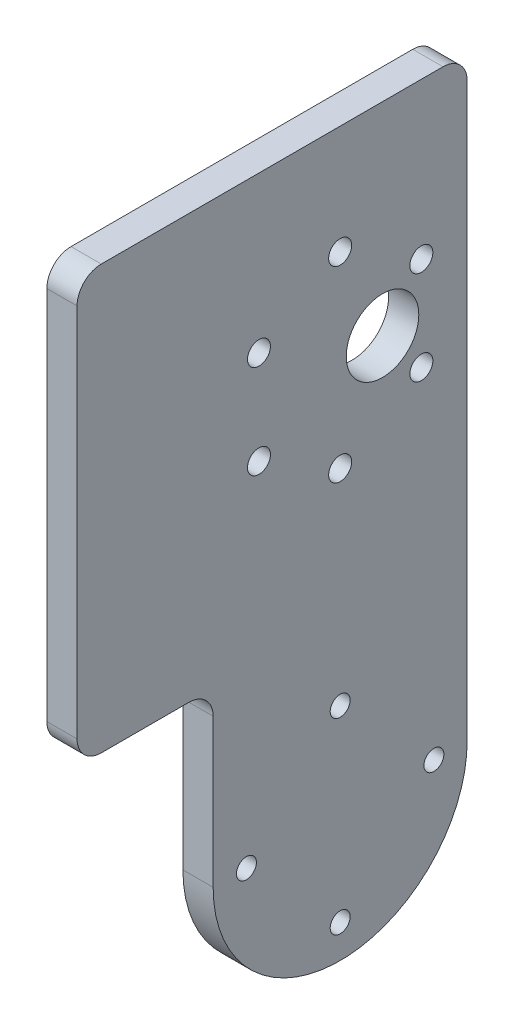
from build123d import *

# Parameters (mm, degrees)
SKETCH1_R           = 1.65
SKETCH1_R_2         = 1.9
SKETCH1_R_3         = 6
BOSS_EXTRUDE1_DEPTH = 5


with BuildPart() as part:
    # Sketch1 → Boss-Extrude1 (new body)
    with BuildSketch(Plane.YZ):
        with BuildLine():
            Line((0, 0), (94.5, 0))
            ThreePointArc((94.5, 0), (97.328427125, 1.171572875), (98.5, 4))
            Line((98.5, 4), (98.5, 60.5))
            ThreePointArc((98.5, 60.5), (97.328427125, 63.328427125), (94.5, 64.5))
            Line((94.5, 64.5), (32.5, 64.5))
            ThreePointArc((32.5, 64.5), (29.671572875, 63.328427125), (28.5, 60.5))
            Line((28.5, 60.5), (28.5, 46))
            ThreePointArc((28.5, 46), (27.328427125, 43.171572875), (24.5, 42))
            Line((24.5, 42), (0, 42))
            ThreePointArc((0, 42), (-21, 21), (0, 0))
        make_face()
        with Locations(Location((-15.5, 21, 0), (0, 0, 270))):
            Circle(SKETCH1_R, mode=Mode.SUBTRACT)
        with Locations(Location((49.5, 21, 0), (0, 0, 270))):
            Circle(SKETCH1_R_2, mode=Mode.SUBTRACT)
        with Locations(Location((65, 14, 0), (0, 0, 270))):
            Circle(SKETCH1_R_3, mode=Mode.SUBTRACT)
        with Locations(Location((57.25, 34.423393759, 0), (0, 0, 270))):
            Circle(SKETCH1_R_2, mode=Mode.SUBTRACT)
        with Locations(Location((72.75, 34.423393759, 0), (0, 0, 270))):
            Circle(SKETCH1_R_2, mode=Mode.SUBTRACT)
        with Locations(Location((80.5, 21, 0), (0, 0, 270))):
            Circle(SKETCH1_R_2, mode=Mode.SUBTRACT)
        with Locations(Location((72.75, 7.576606241, 0), (0, 0, 270))):
            Circle(SKETCH1_R_2, mode=Mode.SUBTRACT)
        with Locations(Location((57.25, 7.576606241, 0), (0, 0, 270))):
            Circle(SKETCH1_R_2, mode=Mode.SUBTRACT)
        with Locations(Location((0, 36.5, 0), (0, 0, 270))):
            Circle(SKETCH1_R, mode=Mode.SUBTRACT)
        with Locations(Location((15.5, 21, 0), (0, 0, 270))):
            Circle(SKETCH1_R, mode=Mode.SUBTRACT)
        with Locations(Location((0, 5.5, 0), (0, 0, 270))):
            Circle(SKETCH1_R, mode=Mode.SUBTRACT)
    extrude(amount=BOSS_EXTRUDE1_DEPTH)


solid = part.part
